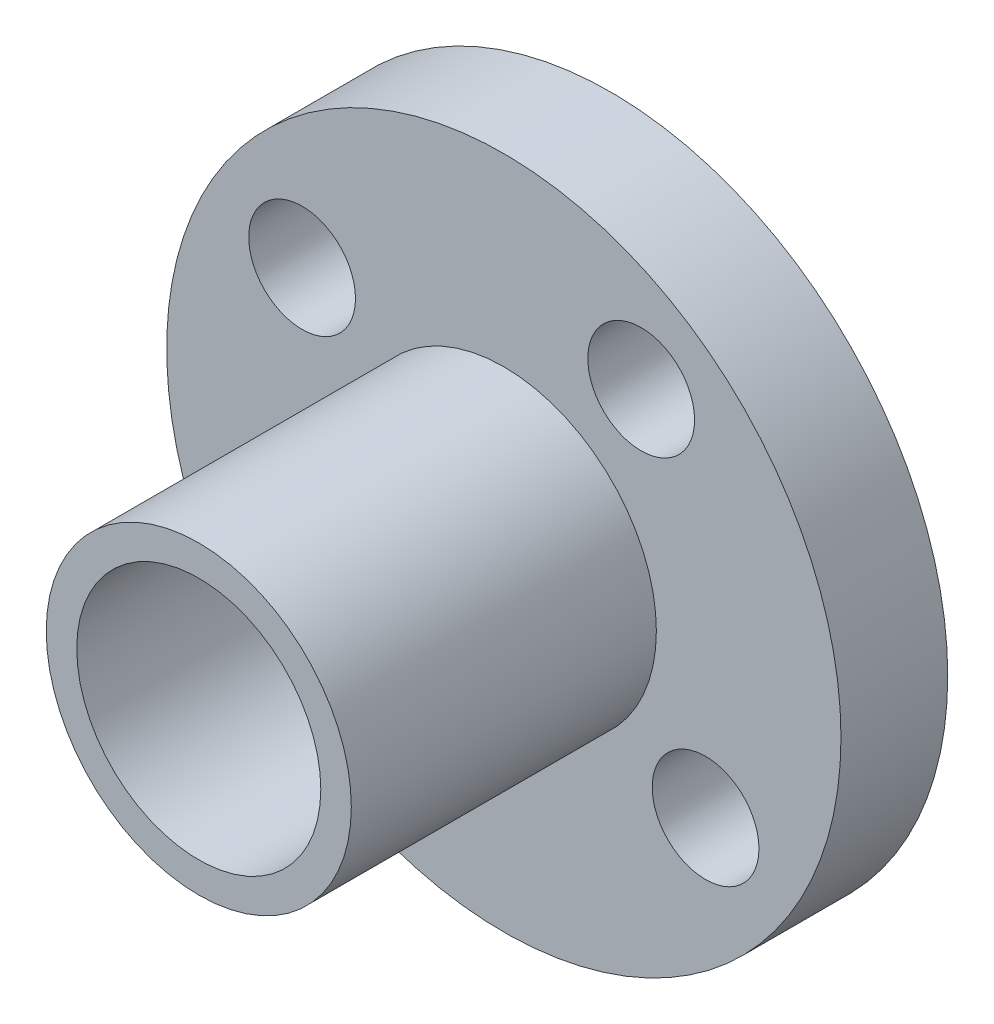
from build123d import *

# Parameters (mm, degrees)
SKETCH_1_R           = 11.051525353
SKETCH_1_R_2         = 1.75
SKETCH_1_R_3         = 5
EXTRUDE_2_DEPTH      = 3.5
EXTRUDE_3_DEPTH      = 13.5
EXTRUDE_3_DEPTH_BACK = 1.5
SKETCH_1_5_R         = 5
SKETCH_1_5_R_2       = 4


with BuildPart() as part:
    # 草图1 → 凸台-拉伸2 (new body)
    with BuildSketch(Plane.XY):
        Circle(SKETCH_1_R)
        with Locations((-4.502000398, -6.613016892)):
            Circle(SKETCH_1_R_2, mode=Mode.SUBTRACT)
        Circle(SKETCH_1_R_3, mode=Mode.SUBTRACT)
        with Locations((6.613016892, -4.502000398)):
            Circle(SKETCH_1_R_2, mode=Mode.SUBTRACT)
        with Locations((-6.613016892, 4.502000398)):
            Circle(SKETCH_1_R_2, mode=Mode.SUBTRACT)
        with Locations((4.502000398, 6.613016892)):
            Circle(SKETCH_1_R_2, mode=Mode.SUBTRACT)
    extrude(amount=EXTRUDE_2_DEPTH)

    # 草图1<5> → 凸台-拉伸3 (add, two sides: drawn at the far end of the back side and taken through both)
    with BuildSketch(Plane.XY.offset(-EXTRUDE_3_DEPTH_BACK)):
        Circle(SKETCH_1_5_R)
        Circle(SKETCH_1_5_R_2, mode=Mode.SUBTRACT)
    extrude(amount=EXTRUDE_3_DEPTH + EXTRUDE_3_DEPTH_BACK)


solid = part.part
